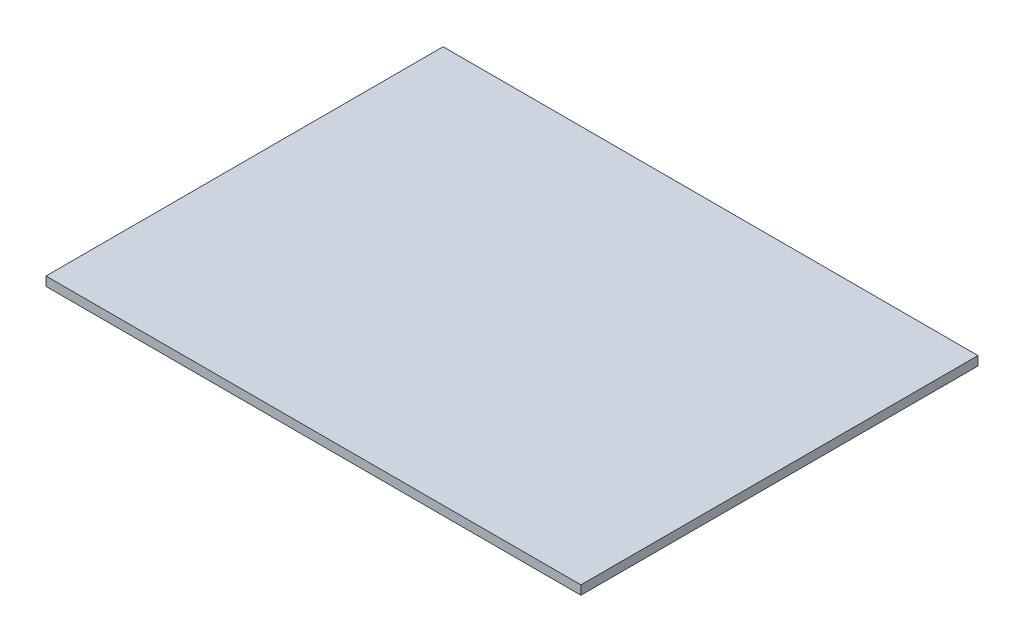
from build123d import *

# Parameters (mm, degrees)
SKETCH1_W           = 91.694
SKETCH1_H           = 68.072
BOSS_EXTRUDE1_DEPTH = 1.5494


with BuildPart() as part:
    # Sketch1 → Boss-Extrude1 (new body)
    with BuildSketch(Plane(origin=(0, 0, 0), x_dir=(1, 0, 0), z_dir=(0, 1, 0))):
        Rectangle(SKETCH1_W, SKETCH1_H)
    extrude(amount=BOSS_EXTRUDE1_DEPTH)


solid = part.part
